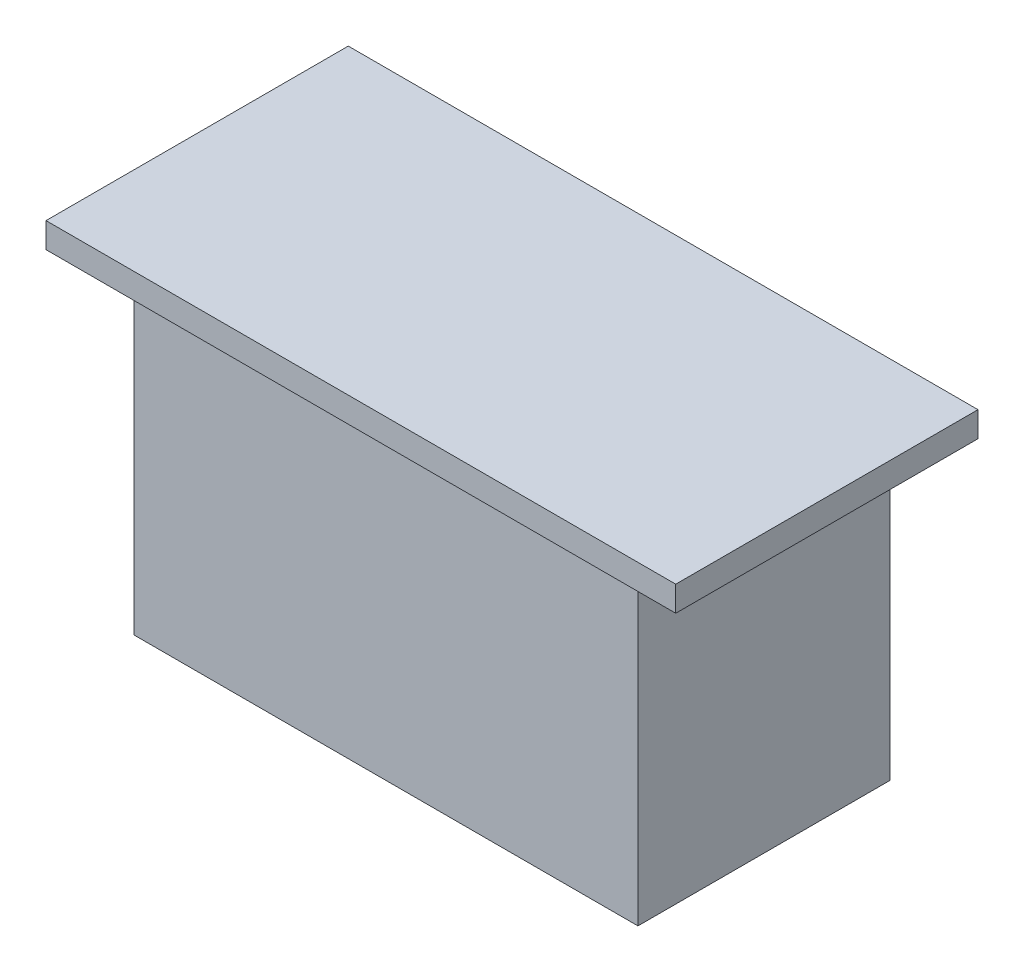
from build123d import *

# Parameters (mm, degrees)
SKETCH1_W           = 25.4
SKETCH1_H           = 12.7
BOSS_EXTRUDE1_DEPTH = 15.875
SKETCH2_W           = 31.75
SKETCH2_H           = 15.24
BOSS_EXTRUDE2_DEPTH = 1.27


with BuildPart() as part:
    # Sketch1 → Boss-Extrude1 (new body)
    with BuildSketch(Plane(origin=(0, 0, 0), x_dir=(1, 0, 0), z_dir=(0, 1, 0))):
        with Locations((2.881458665, -0.367349399)):
            Rectangle(SKETCH1_W, SKETCH1_H)
    extrude(amount=BOSS_EXTRUDE1_DEPTH)

    # Sketch2 → Boss-Extrude2 (add)
    with BuildSketch(Plane(origin=(0, 15.875, 0), x_dir=(1, 0, 0), z_dir=(0, 1, 0))):
        with Locations((2.881458665, -0.367349399)):
            Rectangle(SKETCH2_W, SKETCH2_H)
    extrude(amount=BOSS_EXTRUDE2_DEPTH)


solid = part.part
